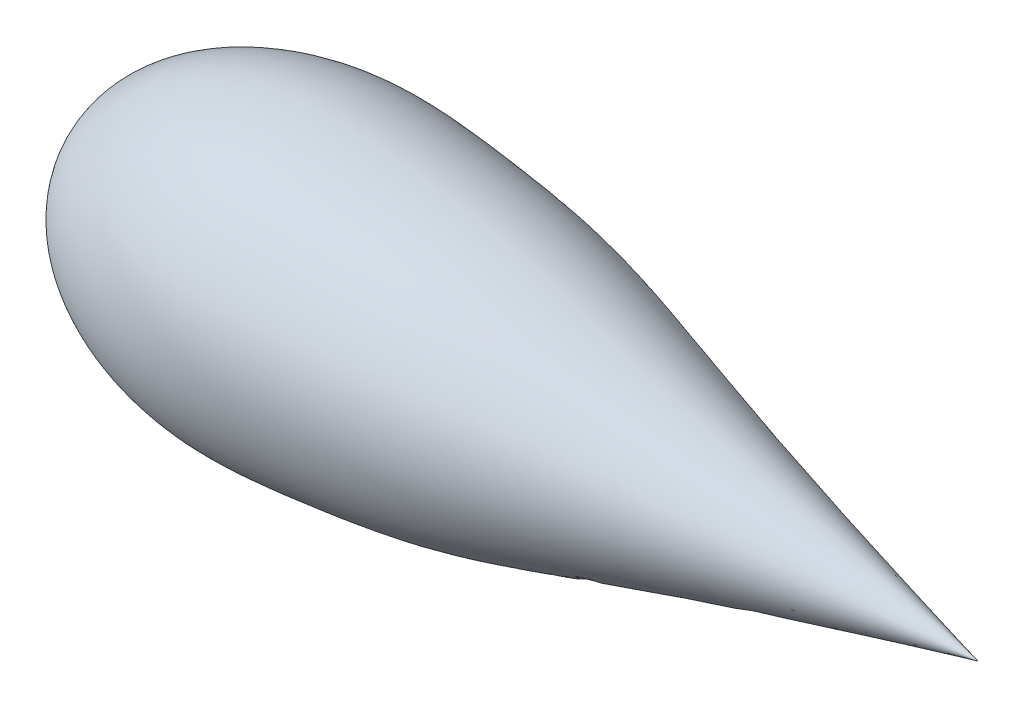
from build123d import *

# Parameters (mm, degrees)
ESCALA1_SCALE = 0.7


with BuildPart() as part:
    # Croquis1 → Revolución1 (revolve)
    with BuildSketch(Plane(origin=(0, 0, 0), x_dir=(0, 1, 0), z_dir=(0, 0, 1))):
        with BuildLine():
            Line((0, 302.511160222), (0, -897.488839778))
            add(Edge.make_bspline(
                [(0, -897.488839778), (145.503958449, -302.775267357), (170.784916525, -369.666045448), (213.653850151, 124.828529679), (118.7591241, 302.511160221), (0, 302.511160222)],
                knots=[0, 0, 0, 0, 0.639219355, 0.739219355, 1, 1, 1, 1], degree=3))
        make_face()
    revolve(axis=Axis((-302.511160222, 0, 0), (1, 0, 0)))


with BuildPart() as part_1:
    # Escala1: scaled about (115.359489773, 0, 0)
    add(part.part.scale(ESCALA1_SCALE).moved(Location((34.607846932, 0, 0))))


solid = part_1.part
